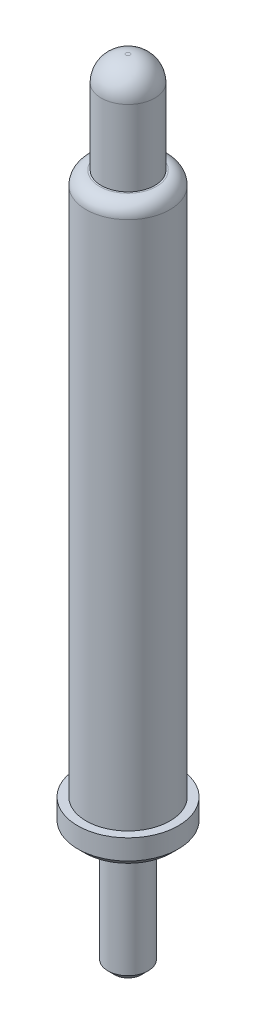
from build123d import *


with BuildPart() as part:
    # Эскиз1 → Повернуть1 (revolve)
    with BuildSketch(Plane(origin=(0, 0, 0), x_dir=(0, 0, -1), z_dir=(1, 0, 0)), mode=Mode.PRIVATE) as revolve_1_sk:
        Polygon((-0.3, 0.1), (-0.3, 1.8), (0, 1.8), (0, 0), (-0.2, 0), align=None)
        Polygon((-0.65, 1.8), (-0.3, 1.8), (0, 1.8), (0, 2.2), (-0.625, 2.2), (-0.75, 2.2), (-0.75, 1.9), align=None)
        with BuildLine():
            Line((-0.625, 2.2), (0, 2.2))
            Line((0, 2.2), (0, 10.3))
            Line((0, 10.3), (-0.4, 10.3))
            Line((-0.4, 10.3), (-0.425, 10.3))
            ThreePointArc((-0.425, 10.3), (-0.566421356, 10.241421356), (-0.625, 10.1))
            Line((-0.625, 10.1), (-0.625, 2.2))
        make_face()
        with BuildLine():
            Line((-0.4, 10.3), (0, 10.3))
            Line((0, 10.3), (0, 11.8))
            Line((0, 11.8), (-0.03, 11.8))
            ThreePointArc((-0.03, 11.8), (-0.291629509, 11.691629509), (-0.4, 11.43))
            Line((-0.4, 11.43), (-0.4, 10.3))
        make_face()
    revolve(revolve_1_sk.sketch.rotate(Axis((0, 0, 0), (0, 1, 0)), 180), axis=Axis((0, 0, 0), (0, 1, 0)))


solid = part.part
